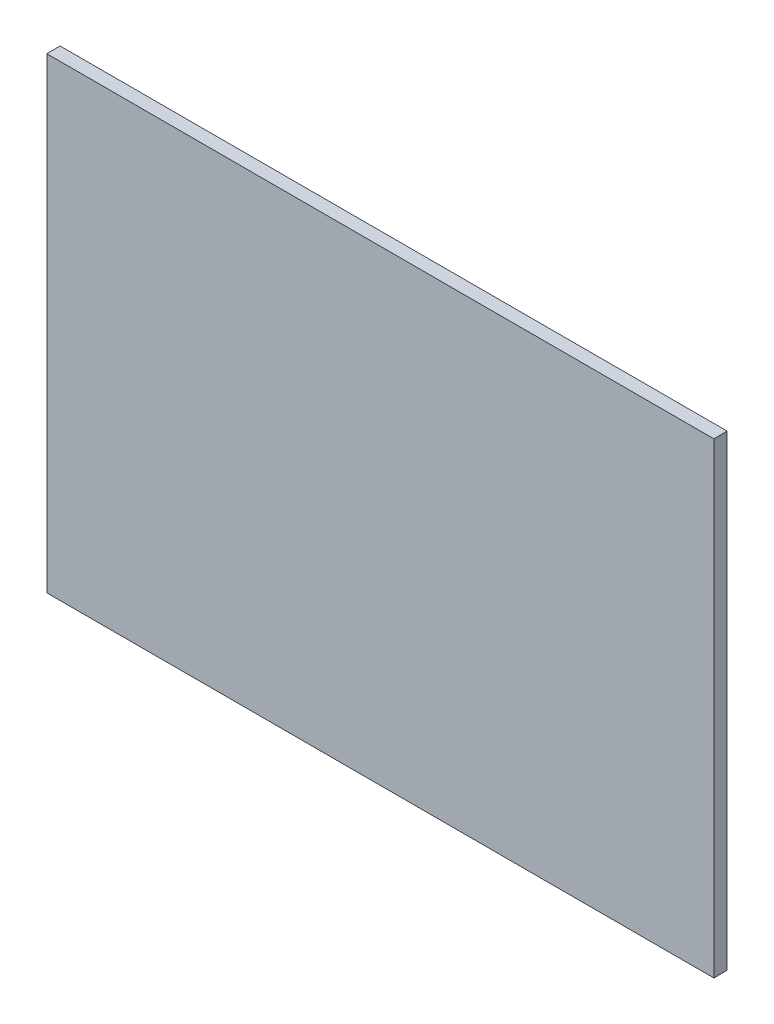
from build123d import *

# Parameters (mm, degrees)
SKETCH1_W           = 1000
SKETCH1_H           = 700
BOSS_EXTRUDE1_DEPTH = 20


with BuildPart() as part:
    # Sketch1 → Boss-Extrude1 (new body)
    with BuildSketch(Plane.XY):
        with Locations((28.664259928, -320.613718412)):
            Rectangle(SKETCH1_W, SKETCH1_H)
    extrude(amount=BOSS_EXTRUDE1_DEPTH)


solid = part.part
